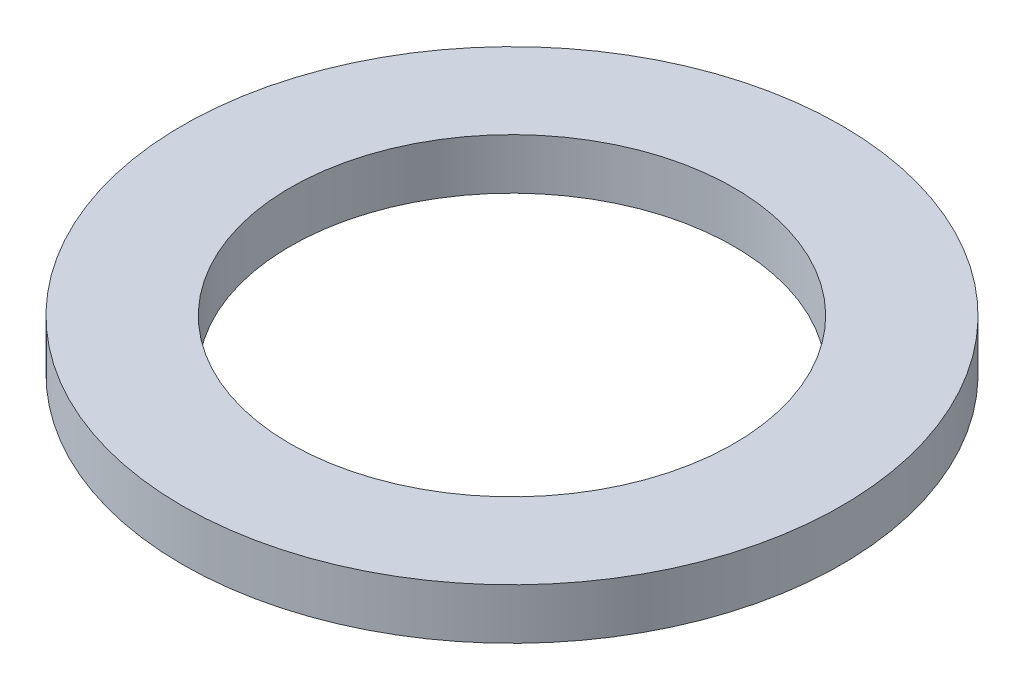
from build123d import *

# Parameters (mm, degrees)
SKETCH2_R           = 26
SKETCH2_R_2         = 17.5
BOSS_EXTRUDE1_DEPTH = 4


with BuildPart() as part:
    # Sketch2 → Boss-Extrude1 (new body)
    with BuildSketch(Plane(origin=(0, 0, 0), x_dir=(1, 0, 0), z_dir=(0, 1, 0))):
        with Locations(Location((0, 0, 0), (0, 0, 270))):
            Circle(SKETCH2_R)
        with Locations(Location((0, 0, 0), (0, 0, 270))):
            Circle(SKETCH2_R_2, mode=Mode.SUBTRACT)
    extrude(amount=BOSS_EXTRUDE1_DEPTH)


solid = part.part
